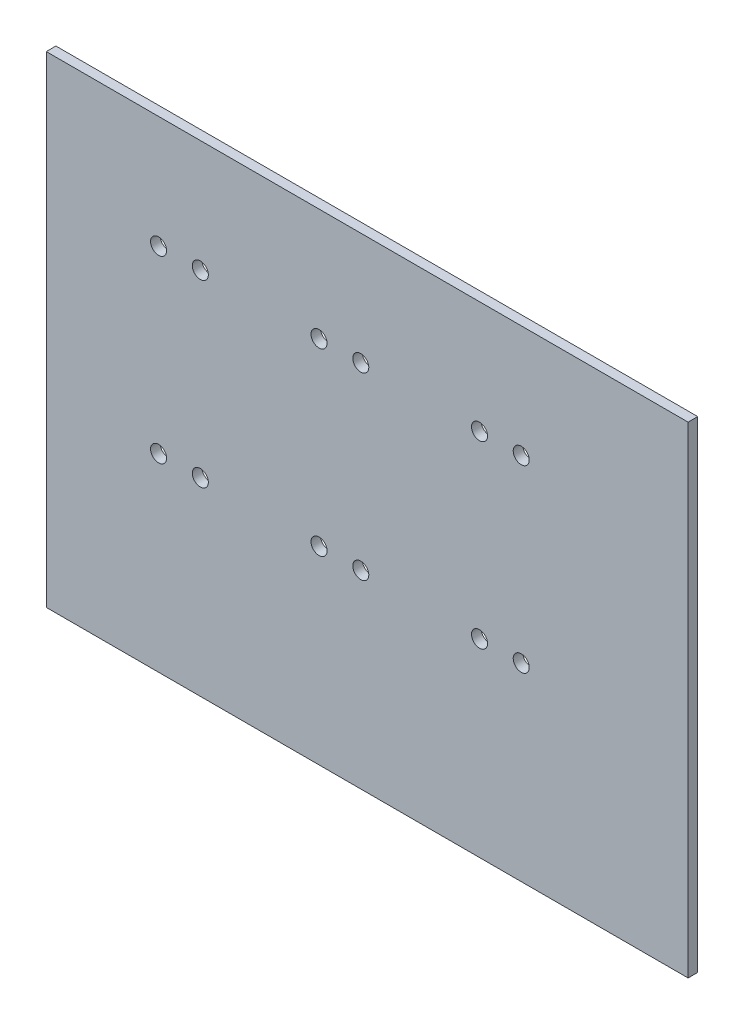
from build123d import *

# Parameters (mm, degrees)
SKICA1_W                 = 200
SKICA1_H                 = 150
P_IDAT_VYSUNUT_M1_DEPTH  = 3
SKICA2_R                 = 2.5
ODEBRAT_VYSUNUT_M1_DEPTH = 126.035994817


with BuildPart() as part:
    # Skica1 → Přidat vysunutím1 (new body)
    with BuildSketch(Plane.XY):
        Rectangle(SKICA1_W, SKICA1_H)
    extrude(amount=P_IDAT_VYSUNUT_M1_DEPTH)

    # Skica2 → Odebrat vysunutím1 (cut, through all)
    with BuildSketch(Plane.XY.offset(3)):
        with Locations((-65, 40)):
            Circle(SKICA2_R)
        with Locations((-52, 40)):
            Circle(SKICA2_R)
        with Locations((-52, -16)):
            Circle(SKICA2_R)
        with Locations((-65, -16)):
            Circle(SKICA2_R)
        with Locations((-15, -16)):
            Circle(SKICA2_R)
        with Locations((-2, -16)):
            Circle(SKICA2_R)
        with Locations((-2, 40)):
            Circle(SKICA2_R)
        with Locations((-15, 40)):
            Circle(SKICA2_R)
        with Locations((35, 40)):
            Circle(SKICA2_R)
        with Locations((48, 40)):
            Circle(SKICA2_R)
        with Locations((48, -16)):
            Circle(SKICA2_R)
        with Locations((35, -16)):
            Circle(SKICA2_R)
    extrude(amount=-ODEBRAT_VYSUNUT_M1_DEPTH, mode=Mode.SUBTRACT)


solid = part.part
